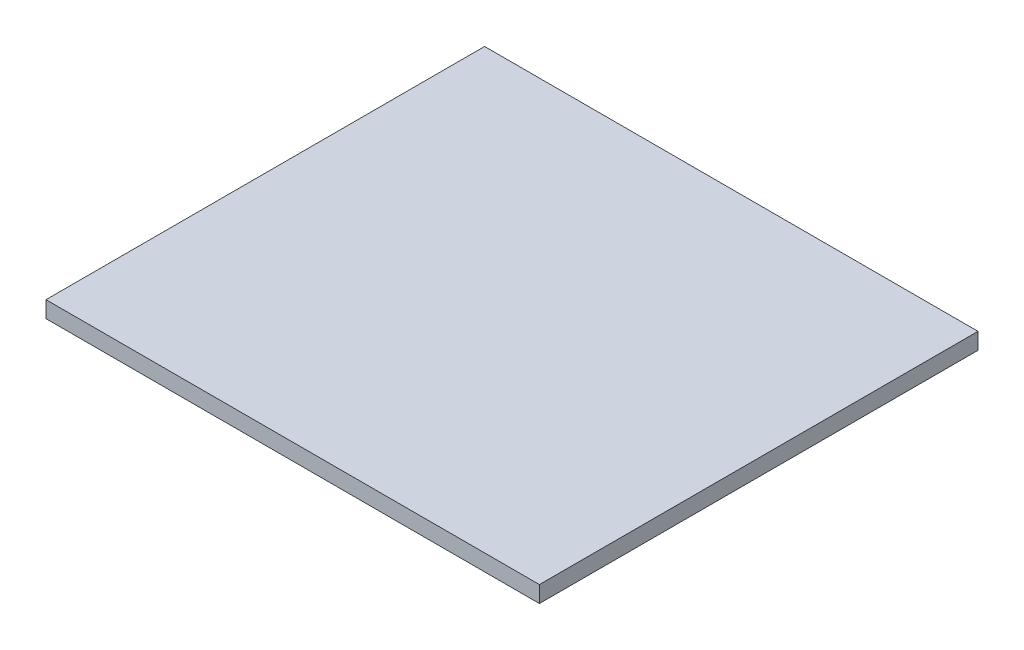
from build123d import *

# Parameters (mm, degrees)
SKETCH_1_W      = 90
SKETCH_1_H      = 80
EXTRUDE_1_DEPTH = 3


with BuildPart() as part:
    # 草图1 → 凸台-拉伸1 (new body)
    with BuildSketch(Plane(origin=(0, 0, 0), x_dir=(1, 0, 0), z_dir=(0, 1, 0))):
        Rectangle(SKETCH_1_W, SKETCH_1_H)
    extrude(amount=EXTRUDE_1_DEPTH)


solid = part.part
